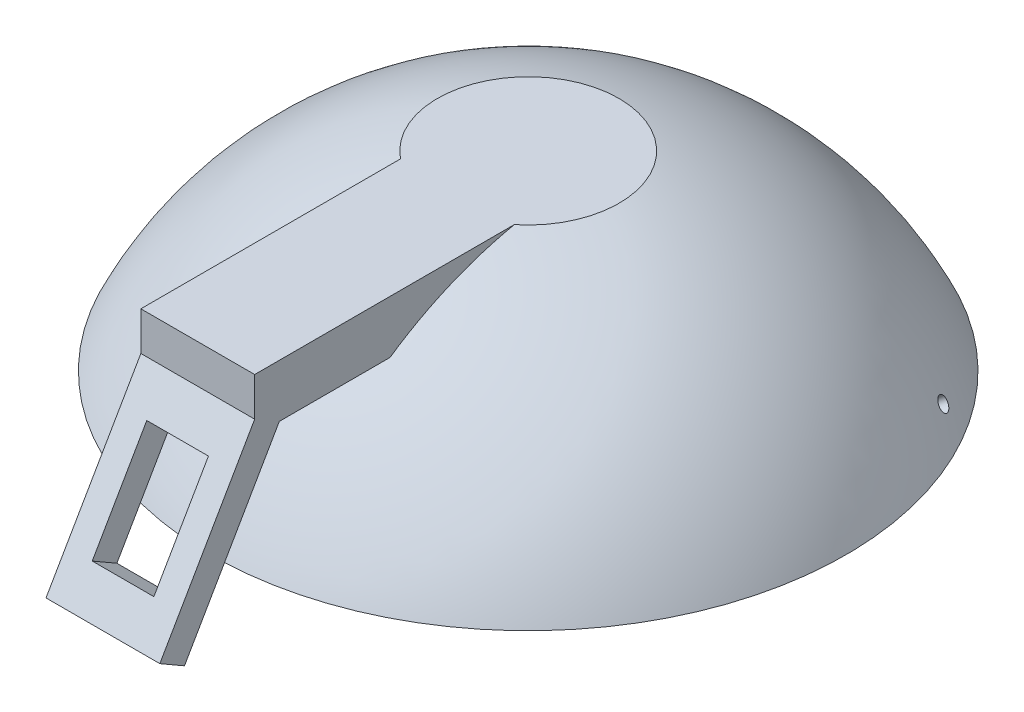
from build123d import *

# Parameters (mm, degrees)
SKETCH_3_R               = 1.5
CUT_EXTRUDE_2_DEPTH      = 119.764820154
PATTERN_CIRCULAR_2_COUNT = 3
SKETCH_4_W               = 24
SKETCH_4_H               = 40
SKETCH_4_W_2             = 13
SKETCH_4_H_2             = 23
EXTRUDE_1_DEPTH          = 6
EXTRUDE_2_REACH          = 122.983
SKETCH_5_W               = 24
SKETCH_5_H               = 5.196152423
EXTRUDE_3_REACH          = 166.046
SKETCH_8_W               = 24
SKETCH_8_H               = 11.158003069


with BuildPart() as part:
    # 草图1 → 旋转1 (revolve)
    with BuildSketch(Plane.XY):
        with BuildLine():
            Line((19.152609338, 71.478511145), (0, 71.478511145))
            Line((0, 71.478511145), (0, 67.478511145))
            Line((0, 67.478511145), (18.618553478, 67.478511145))
            ThreePointArc((18.618553478, 67.478511145), (45.193772934, 53.455803127), (63.441545093, 29.583278322))
            Line((63.441545093, 29.583278322), (67.066776241, 31.273751369))
            ThreePointArc((67.066776241, 31.273751369), (47.566283117, 56.687288791), (19.152609338, 71.478511145))
        make_face()
    revolve(axis=Axis((0, 0, 0), (0, 1, 0)))

    # 草图3 → 切除-拉伸2 (cut, through all)
    with BuildSketch(Plane(origin=(0, 0, 0), x_dir=(-1, 0, 0), z_dir=(0, 0.500000000000001, 0.866025403784438))):
        Circle(SKETCH_3_R)
    cut_extrude_2 = extrude(amount=CUT_EXTRUDE_2_DEPTH, mode=Mode.SUBTRACT)

    # 阵列(圆周)2: 切除-拉伸2 ×3 about axis
    pattern_circular_2_axis = Axis((0, 71.478511145, 0), (0, -1, 0))
    for i in range(1, PATTERN_CIRCULAR_2_COUNT):
        add(cut_extrude_2.rotate(pattern_circular_2_axis, i * 360 / PATTERN_CIRCULAR_2_COUNT), mode=Mode.SUBTRACT)

    # 草图8 → 凸台-拉伸3 (add, up to next)
    with BuildSketch(Plane(origin=(0, 0, 64.478184725), x_dir=(-1, 0, 0), z_dir=(0, 0, -1)), mode=Mode.PRIVATE) as extrude_3_sk1:
        with Locations((0, 65.899509611)):
            Rectangle(SKETCH_8_W, SKETCH_8_H)
    extrude_3_tool1 = extrude(extrude_3_sk1.sketch, amount=EXTRUDE_3_REACH, mode=Mode.PRIVATE) - part.part


with BuildPart() as body_2:
    # 草图4 → 凸台-拉伸1 (new body)
    with BuildSketch(Plane(origin=(0, 43, 74.478184725), x_dir=(-1, 0, 0), z_dir=(0, 0.500000000000001, 0.866025403784438))):
        Rectangle(SKETCH_4_W, SKETCH_4_H)
        Rectangle(SKETCH_4_W_2, SKETCH_4_H_2, mode=Mode.SUBTRACT)
    extrude(amount=EXTRUDE_1_DEPTH)

    # 草图5 → 凸台-拉伸2 (add, up to next)
    with BuildSketch(Plane(origin=(0, 71.478511145, 0), x_dir=(1, 0, 0), z_dir=(0, 1, 0)), mode=Mode.PRIVATE) as extrude_2_sk1:
        with Locations((0, -67.076260937)):
            Rectangle(SKETCH_5_W, SKETCH_5_H)
    extrude_2_tool1 = extrude(extrude_2_sk1.sketch, amount=-EXTRUDE_2_REACH, mode=Mode.PRIVATE) - body_2.part
    add(extrude_2_tool1.solids().sort_by_distance((0, 71.478511, 67.076261))[0])


with BuildPart() as part_1:
    add(part.part)

    add(body_2.part)  # 凸台-拉伸3 merges body 2
    add(extrude_3_tool1.solids().sort_by_distance((0, 65.89951, 64.478185))[0])


solid = part_1.part
